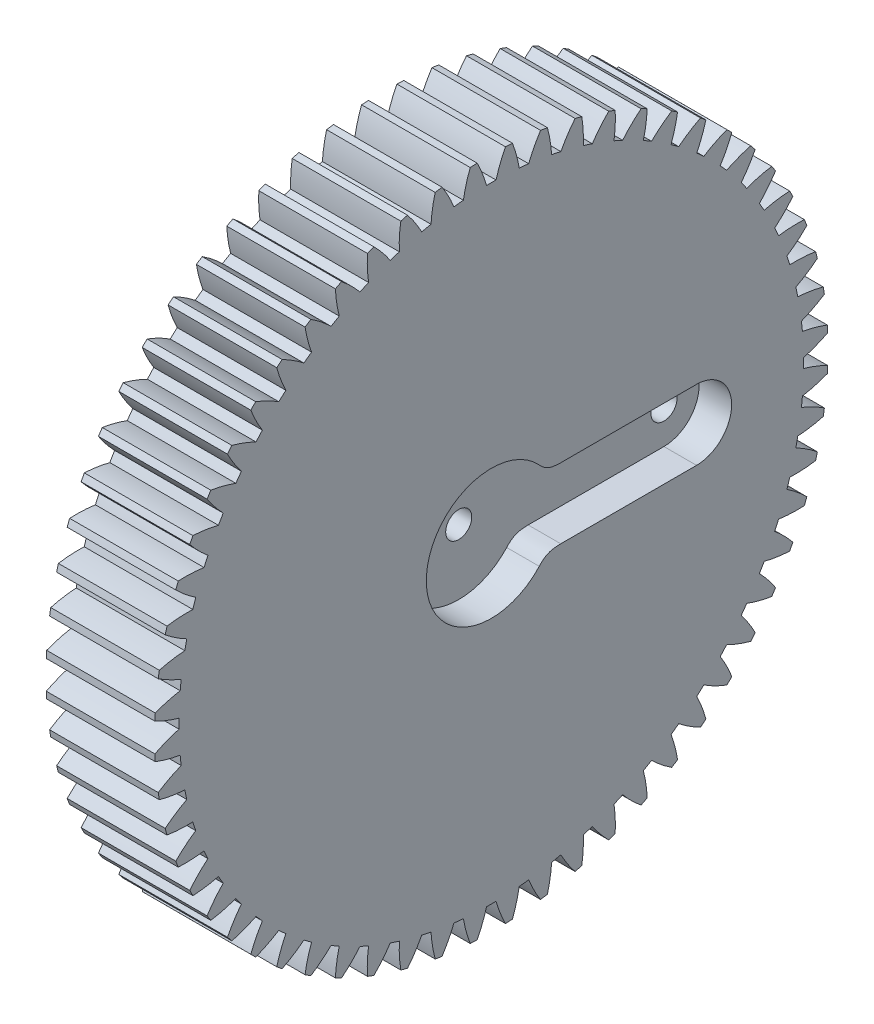
from build123d import *

# Parameters (mm, degrees)
SKETCH1_R           = 3.175
BOSS_EXTRUDE1_DEPTH = 12.7
CUT_EXTRUDE1_DEPTH  = 3.81
SKETCH4_R           = 1.524
CUT_EXTRUDE2_DEPTH  = 57.334221032
SKETCH5_R           = 3.175
CUT_EXTRUDE3_DEPTH  = 2.54
BOSS_EXTRUDE2_START = -8.89
SKETCH6_R           = 3.175
SKETCH6_R_2         = 1.524
BOSS_EXTRUDE2_DEPTH = 6.35


with BuildPart() as part:
    # Sketch1 → Boss-Extrude1 (new body)
    with BuildSketch(Plane(origin=(0, 0, 0), x_dir=(0, 0, -1), z_dir=(1, 0, 0))):
        with BuildLine():
            ThreePointArc((-39.335177282, 1.655514489), (-37.955442803, 1.035058015), (-36.520991483, 0.554451235))
            ThreePointArc((-36.520991483, 0.554451235), (-36.5252, 0), (-36.520991483, -0.554451235))
            ThreePointArc((-36.520991483, -0.554451235), (-37.955442803, -1.035058015), (-39.335177282, -1.655514489))
            ThreePointArc((-39.335177282, -1.655514489), (-39.316044783, -2.060466597), (-39.29274345, -2.465200226))
            ThreePointArc((-39.29274345, -2.465200226), (-37.85571194, -2.93803625), (-36.378881605, -3.266069224))
            ThreePointArc((-36.378881605, -3.266069224), (-36.325111133, -3.817923027), (-36.262969734, -4.36889701))
            ThreePointArc((-36.262969734, -4.36889701), (-37.639325892, -4.996811967), (-38.946646679, -5.758091041))
            ThreePointArc((-38.946646679, -5.758091041), (-38.885289969, -6.158824889), (-38.819810099, -6.558905692))
            ThreePointArc((-38.819810099, -6.558905692), (-37.341225974, -6.878940775), (-35.838197089, -7.050805945))
            ThreePointArc((-35.838197089, -7.050805945), (-35.727036746, -7.594016089), (-35.607643301, -8.135476234))
            ThreePointArc((-35.607643301, -8.135476234), (-36.910824651, -8.903819803), (-38.131408466, -9.797580742))
            ThreePointArc((-38.131408466, -9.797580742), (-38.028499781, -10.189705806), (-37.921558785, -10.580750414))
            ThreePointArc((-37.921558785, -10.580750414), (-36.417621723, -10.744478186), (-34.904861785, -10.75829256))
            ThreePointArc((-34.904861785, -10.75829256), (-34.737529469, -11.286907523), (-34.562192077, -11.812921479))
            ThreePointArc((-34.562192077, -11.812921479), (-35.77792069, -12.713275525), (-36.898394562, -13.729726099))
            ThreePointArc((-36.898394562, -13.729726099), (-36.755061391, -14.108946174), (-36.607830937, -14.486670221))
            ThreePointArc((-36.607830937, -14.486670221), (-35.095018388, -14.492296845), (-33.589101511, -14.34790907))
            ThreePointArc((-33.589101511, -14.34790907), (-33.367430549, -14.856137236), (-33.138070244, -15.360941884))
            ThreePointArc((-33.138070244, -15.360941884), (-34.253026343, -16.38344194), (-35.261114125, -17.511445704))
            ThreePointArc((-35.261114125, -17.511445704), (-35.078926857, -17.873605975), (-34.893020033, -18.233871037))
            ThreePointArc((-34.893020033, -18.233871037), (-33.387906687, -18.081334866), (-31.905332013, -17.780326887))
            ThreePointArc((-31.905332013, -17.780326887), (-31.631751078, -18.2626), (-31.350880778, -18.740664596))
            ThreePointArc((-31.350880778, -18.740664596), (-32.352848672, -19.874107937), (-33.237505544, -21.101306244))
            ThreePointArc((-33.237505544, -21.101306244), (-33.01846026, -21.442438809), (-32.795913899, -21.781297747))
            ThreePointArc((-32.795913899, -21.781297747), (-31.314990093, -21.47227), (-29.87200102, -21.017939721))
            ThreePointArc((-29.87200102, -21.017939721), (-29.549507523, -21.468973897), (-29.220204502, -21.915060664))
            ThreePointArc((-29.220204502, -21.915060664), (-30.09820642, -23.147029048), (-30.849739896, -24.459976458))
            ThreePointArc((-30.849739896, -24.459976458), (-30.596236503, -24.776343796), (-30.33948887, -25.090084))
            ThreePointArc((-30.33948887, -25.090084), (-28.898979915, -24.62795045), (-27.511386132, -24.025275609))
            ThreePointArc((-27.511386132, -24.025275609), (-27.14351338, -24.440129223), (-26.769385551, -24.849350742))
            ThreePointArc((-26.769385551, -24.849350742), (-27.513801921, -26.166346465), (-28.123978042, -27.550658052))
            ThreePointArc((-28.123978042, -27.550658052), (-27.838793975, -27.838793975), (-27.550658052, -28.123978042))
            ThreePointArc((-27.550658052, -28.123978042), (-26.166346465, -27.513801921), (-24.849350742, -26.769385551))
            ThreePointArc((-24.849350742, -26.769385551), (-24.440129223, -27.14351338), (-24.025275609, -27.511386132))
            ThreePointArc((-24.025275609, -27.511386132), (-24.62795045, -28.898979915), (-25.090084, -30.33948887))
            ThreePointArc((-25.090084, -30.33948887), (-24.776343796, -30.596236503), (-24.459976458, -30.849739896))
            ThreePointArc((-24.459976458, -30.849739896), (-23.147029048, -30.09820642), (-21.915060664, -29.220204502))
            ThreePointArc((-21.915060664, -29.220204502), (-21.468973897, -29.549507523), (-21.017939721, -29.87200102))
            ThreePointArc((-21.017939721, -29.87200102), (-21.47227, -31.314990093), (-21.781297747, -32.795913899))
            ThreePointArc((-21.781297747, -32.795913899), (-21.442438809, -33.01846026), (-21.101306244, -33.237505544))
            ThreePointArc((-21.101306244, -33.237505544), (-19.874107937, -32.352848672), (-18.740664596, -31.350880778))
            ThreePointArc((-18.740664596, -31.350880778), (-18.2626, -31.631751078), (-17.780326887, -31.905332013))
            ThreePointArc((-17.780326887, -31.905332013), (-18.081334866, -33.387906687), (-18.233871037, -34.893020033))
            ThreePointArc((-18.233871037, -34.893020033), (-17.873605975, -35.078926857), (-17.511445704, -35.261114125))
            ThreePointArc((-17.511445704, -35.261114125), (-16.38344194, -34.253026343), (-15.360941884, -33.138070244))
            ThreePointArc((-15.360941884, -33.138070244), (-14.856137236, -33.367430549), (-14.34790907, -33.589101511))
            ThreePointArc((-14.34790907, -33.589101511), (-14.492296845, -35.095018388), (-14.486670221, -36.607830937))
            ThreePointArc((-14.486670221, -36.607830937), (-14.108946174, -36.755061391), (-13.729726099, -36.898394562))
            ThreePointArc((-13.729726099, -36.898394562), (-12.713275525, -35.77792069), (-11.812921479, -34.562192077))
            ThreePointArc((-11.812921479, -34.562192077), (-11.286907523, -34.737529469), (-10.75829256, -34.904861785))
            ThreePointArc((-10.75829256, -34.904861785), (-10.744478186, -36.417621723), (-10.580750414, -37.921558785))
            ThreePointArc((-10.580750414, -37.921558785), (-10.189705806, -38.028499781), (-9.797580742, -38.131408466))
            ThreePointArc((-9.797580742, -38.131408466), (-8.903819803, -36.910824651), (-8.135476234, -35.607643301))
            ThreePointArc((-8.135476234, -35.607643301), (-7.594016089, -35.727036746), (-7.050805945, -35.838197089))
            ThreePointArc((-7.050805945, -35.838197089), (-6.878940775, -37.341225974), (-6.558905692, -38.819810099))
            ThreePointArc((-6.558905692, -38.819810099), (-6.158824889, -38.885289969), (-5.758091041, -38.946646679))
            ThreePointArc((-5.758091041, -38.946646679), (-4.996811967, -37.639325892), (-4.36889701, -36.262969734))
            ThreePointArc((-4.36889701, -36.262969734), (-3.817923027, -36.325111133), (-3.266069224, -36.378881605))
            ThreePointArc((-3.266069224, -36.378881605), (-2.93803625, -37.85571194), (-2.465200226, -39.29274345))
            ThreePointArc((-2.465200226, -39.29274345), (-2.060466597, -39.316044783), (-1.655514489, -39.335177282))
            ThreePointArc((-1.655514489, -39.335177282), (-1.035058015, -37.955442803), (-0.554451235, -36.520991483))
            ThreePointArc((-0.554451235, -36.520991483), (0, -36.5252), (0.554451235, -36.520991483))
            ThreePointArc((0.554451235, -36.520991483), (1.035058015, -37.955442803), (1.655514489, -39.335177282))
            ThreePointArc((1.655514489, -39.335177282), (2.060466597, -39.316044783), (2.465200226, -39.29274345))
            ThreePointArc((2.465200226, -39.29274345), (2.93803625, -37.85571194), (3.266069224, -36.378881605))
            ThreePointArc((3.266069224, -36.378881605), (3.817923027, -36.325111133), (4.36889701, -36.262969734))
            ThreePointArc((4.36889701, -36.262969734), (4.996811967, -37.639325892), (5.758091041, -38.946646679))
            ThreePointArc((5.758091041, -38.946646679), (6.158824889, -38.885289969), (6.558905692, -38.819810099))
            ThreePointArc((6.558905692, -38.819810099), (6.878940775, -37.341225974), (7.050805945, -35.838197089))
            ThreePointArc((7.050805945, -35.838197089), (7.594016089, -35.727036746), (8.135476234, -35.607643301))
            ThreePointArc((8.135476234, -35.607643301), (8.903819803, -36.910824651), (9.797580742, -38.131408466))
            ThreePointArc((9.797580742, -38.131408466), (10.189705806, -38.028499781), (10.580750414, -37.921558785))
            ThreePointArc((10.580750414, -37.921558785), (10.744478186, -36.417621723), (10.75829256, -34.904861785))
            ThreePointArc((10.75829256, -34.904861785), (11.286907523, -34.737529469), (11.812921479, -34.562192077))
            ThreePointArc((11.812921479, -34.562192077), (12.713275525, -35.77792069), (13.729726099, -36.898394562))
            ThreePointArc((13.729726099, -36.898394562), (14.108946174, -36.755061391), (14.486670221, -36.607830937))
            ThreePointArc((14.486670221, -36.607830937), (14.492296845, -35.095018388), (14.34790907, -33.589101511))
            ThreePointArc((14.34790907, -33.589101511), (14.856137236, -33.367430549), (15.360941884, -33.138070244))
            ThreePointArc((15.360941884, -33.138070244), (16.38344194, -34.253026343), (17.511445704, -35.261114125))
            ThreePointArc((17.511445704, -35.261114125), (17.873605975, -35.078926857), (18.233871037, -34.893020033))
            ThreePointArc((18.233871037, -34.893020033), (18.081334866, -33.387906687), (17.780326887, -31.905332013))
            ThreePointArc((17.780326887, -31.905332013), (18.2626, -31.631751078), (18.740664596, -31.350880778))
            ThreePointArc((18.740664596, -31.350880778), (19.874107937, -32.352848672), (21.101306244, -33.237505544))
            ThreePointArc((21.101306244, -33.237505544), (21.442438809, -33.01846026), (21.781297747, -32.795913899))
            ThreePointArc((21.781297747, -32.795913899), (21.47227, -31.314990093), (21.017939721, -29.87200102))
            ThreePointArc((21.017939721, -29.87200102), (21.468973897, -29.549507523), (21.915060664, -29.220204502))
            ThreePointArc((21.915060664, -29.220204502), (23.147029048, -30.09820642), (24.459976458, -30.849739896))
            ThreePointArc((24.459976458, -30.849739896), (24.776343796, -30.596236503), (25.090084, -30.33948887))
            ThreePointArc((25.090084, -30.33948887), (24.62795045, -28.898979915), (24.025275609, -27.511386132))
            ThreePointArc((24.025275609, -27.511386132), (24.440129223, -27.14351338), (24.849350742, -26.769385551))
            ThreePointArc((24.849350742, -26.769385551), (26.166346465, -27.513801921), (27.550658052, -28.123978042))
            ThreePointArc((27.550658052, -28.123978042), (27.838793975, -27.838793975), (28.123978042, -27.550658052))
            ThreePointArc((28.123978042, -27.550658052), (27.513801921, -26.166346465), (26.769385551, -24.849350742))
            ThreePointArc((26.769385551, -24.849350742), (27.14351338, -24.440129223), (27.511386132, -24.025275609))
            ThreePointArc((27.511386132, -24.025275609), (28.898979915, -24.62795045), (30.33948887, -25.090084))
            ThreePointArc((30.33948887, -25.090084), (30.596236503, -24.776343796), (30.849739896, -24.459976458))
            ThreePointArc((30.849739896, -24.459976458), (30.09820642, -23.147029048), (29.220204502, -21.915060664))
            ThreePointArc((29.220204502, -21.915060664), (29.549507523, -21.468973897), (29.87200102, -21.017939721))
            ThreePointArc((29.87200102, -21.017939721), (31.314990093, -21.47227), (32.795913899, -21.781297747))
            ThreePointArc((32.795913899, -21.781297747), (33.01846026, -21.442438809), (33.237505544, -21.101306244))
            ThreePointArc((33.237505544, -21.101306244), (32.352848672, -19.874107937), (31.350880778, -18.740664596))
            ThreePointArc((31.350880778, -18.740664596), (31.631751078, -18.2626), (31.905332013, -17.780326887))
            ThreePointArc((31.905332013, -17.780326887), (33.387906687, -18.081334866), (34.893020033, -18.233871037))
            ThreePointArc((34.893020033, -18.233871037), (35.078926857, -17.873605975), (35.261114125, -17.511445704))
            ThreePointArc((35.261114125, -17.511445704), (34.253026343, -16.38344194), (33.138070244, -15.360941884))
            ThreePointArc((33.138070244, -15.360941884), (33.367430549, -14.856137236), (33.589101511, -14.34790907))
            ThreePointArc((33.589101511, -14.34790907), (35.095018388, -14.492296845), (36.607830937, -14.486670221))
            ThreePointArc((36.607830937, -14.486670221), (36.755061391, -14.108946174), (36.898394562, -13.729726099))
            ThreePointArc((36.898394562, -13.729726099), (35.77792069, -12.713275525), (34.562192077, -11.812921479))
            ThreePointArc((34.562192077, -11.812921479), (34.737529469, -11.286907523), (34.904861785, -10.75829256))
            ThreePointArc((34.904861785, -10.75829256), (36.417621723, -10.744478186), (37.921558785, -10.580750414))
            ThreePointArc((37.921558785, -10.580750414), (38.028499781, -10.189705806), (38.131408466, -9.797580742))
            ThreePointArc((38.131408466, -9.797580742), (36.910824651, -8.903819803), (35.607643301, -8.135476234))
            ThreePointArc((35.607643301, -8.135476234), (35.727036746, -7.594016089), (35.838197089, -7.050805945))
            ThreePointArc((35.838197089, -7.050805945), (37.341225974, -6.878940775), (38.819810099, -6.558905692))
            ThreePointArc((38.819810099, -6.558905692), (38.885289969, -6.158824889), (38.946646679, -5.758091041))
            ThreePointArc((38.946646679, -5.758091041), (37.639325892, -4.996811967), (36.262969734, -4.36889701))
            ThreePointArc((36.262969734, -4.36889701), (36.325111133, -3.817923027), (36.378881605, -3.266069224))
            ThreePointArc((36.378881605, -3.266069224), (37.85571194, -2.93803625), (39.29274345, -2.465200226))
            ThreePointArc((39.29274345, -2.465200226), (39.316044783, -2.060466597), (39.335177282, -1.655514489))
            ThreePointArc((39.335177282, -1.655514489), (37.955442803, -1.035058015), (36.520991483, -0.554451235))
            ThreePointArc((36.520991483, -0.554451235), (36.5252, 0), (36.520991483, 0.554451235))
            ThreePointArc((36.520991483, 0.554451235), (37.955442803, 1.035058015), (39.335177282, 1.655514489))
            ThreePointArc((39.335177282, 1.655514489), (39.316044783, 2.060466597), (39.29274345, 2.465200226))
            ThreePointArc((39.29274345, 2.465200226), (37.85571194, 2.93803625), (36.378881605, 3.266069224))
            ThreePointArc((36.378881605, 3.266069224), (36.325111133, 3.817923027), (36.262969734, 4.36889701))
            ThreePointArc((36.262969734, 4.36889701), (37.639325892, 4.996811967), (38.946646679, 5.758091041))
            ThreePointArc((38.946646679, 5.758091041), (38.885289969, 6.158824889), (38.819810099, 6.558905692))
            ThreePointArc((38.819810099, 6.558905692), (37.341225974, 6.878940775), (35.838197089, 7.050805945))
            ThreePointArc((35.838197089, 7.050805945), (35.727036746, 7.594016089), (35.607643301, 8.135476234))
            ThreePointArc((35.607643301, 8.135476234), (36.910824651, 8.903819803), (38.131408466, 9.797580742))
            ThreePointArc((38.131408466, 9.797580742), (38.028499781, 10.189705806), (37.921558785, 10.580750414))
            ThreePointArc((37.921558785, 10.580750414), (36.417621723, 10.744478186), (34.904861785, 10.75829256))
            ThreePointArc((34.904861785, 10.75829256), (34.737529469, 11.286907523), (34.562192077, 11.812921479))
            ThreePointArc((34.562192077, 11.812921479), (35.77792069, 12.713275525), (36.898394562, 13.729726099))
            ThreePointArc((36.898394562, 13.729726099), (36.755061391, 14.108946174), (36.607830937, 14.486670221))
            ThreePointArc((36.607830937, 14.486670221), (35.095018388, 14.492296845), (33.589101511, 14.34790907))
            ThreePointArc((33.589101511, 14.34790907), (33.367430549, 14.856137236), (33.138070244, 15.360941884))
            ThreePointArc((33.138070244, 15.360941884), (34.253026343, 16.38344194), (35.261114125, 17.511445704))
            ThreePointArc((35.261114125, 17.511445704), (35.078926857, 17.873605975), (34.893020033, 18.233871037))
            ThreePointArc((34.893020033, 18.233871037), (33.387906687, 18.081334866), (31.905332013, 17.780326887))
            ThreePointArc((31.905332013, 17.780326887), (31.631751078, 18.2626), (31.350880778, 18.740664596))
            ThreePointArc((31.350880778, 18.740664596), (32.352848672, 19.874107937), (33.237505544, 21.101306244))
            ThreePointArc((33.237505544, 21.101306244), (33.01846026, 21.442438809), (32.795913899, 21.781297747))
            ThreePointArc((32.795913899, 21.781297747), (31.314990093, 21.47227), (29.87200102, 21.017939721))
            ThreePointArc((29.87200102, 21.017939721), (29.549507523, 21.468973897), (29.220204502, 21.915060664))
            ThreePointArc((29.220204502, 21.915060664), (30.09820642, 23.147029048), (30.849739896, 24.459976458))
            ThreePointArc((30.849739896, 24.459976458), (30.596236503, 24.776343796), (30.33948887, 25.090084))
            ThreePointArc((30.33948887, 25.090084), (28.898979915, 24.62795045), (27.511386132, 24.025275609))
            ThreePointArc((27.511386132, 24.025275609), (27.14351338, 24.440129223), (26.769385551, 24.849350742))
            ThreePointArc((26.769385551, 24.849350742), (27.513801921, 26.166346465), (28.123978042, 27.550658052))
            ThreePointArc((28.123978042, 27.550658052), (27.838793975, 27.838793975), (27.550658052, 28.123978042))
            ThreePointArc((27.550658052, 28.123978042), (26.166346465, 27.513801921), (24.849350742, 26.769385551))
            ThreePointArc((24.849350742, 26.769385551), (24.440129223, 27.14351338), (24.025275609, 27.511386132))
            ThreePointArc((24.025275609, 27.511386132), (24.62795045, 28.898979915), (25.090084, 30.33948887))
            ThreePointArc((25.090084, 30.33948887), (24.776343796, 30.596236503), (24.459976458, 30.849739896))
            ThreePointArc((24.459976458, 30.849739896), (23.147029048, 30.09820642), (21.915060664, 29.220204502))
            ThreePointArc((21.915060664, 29.220204502), (21.468973897, 29.549507523), (21.017939721, 29.87200102))
            ThreePointArc((21.017939721, 29.87200102), (21.47227, 31.314990093), (21.781297747, 32.795913899))
            ThreePointArc((21.781297747, 32.795913899), (21.442438809, 33.01846026), (21.101306244, 33.237505544))
            ThreePointArc((21.101306244, 33.237505544), (19.874107937, 32.352848672), (18.740664596, 31.350880778))
            ThreePointArc((18.740664596, 31.350880778), (18.2626, 31.631751078), (17.780326887, 31.905332013))
            ThreePointArc((17.780326887, 31.905332013), (18.081334866, 33.387906687), (18.233871037, 34.893020033))
            ThreePointArc((18.233871037, 34.893020033), (17.873605975, 35.078926857), (17.511445704, 35.261114125))
            ThreePointArc((17.511445704, 35.261114125), (16.38344194, 34.253026343), (15.360941884, 33.138070244))
            ThreePointArc((15.360941884, 33.138070244), (14.856137236, 33.367430549), (14.34790907, 33.589101511))
            ThreePointArc((14.34790907, 33.589101511), (14.492296845, 35.095018388), (14.486670221, 36.607830937))
            ThreePointArc((14.486670221, 36.607830937), (14.108946174, 36.755061391), (13.729726099, 36.898394562))
            ThreePointArc((13.729726099, 36.898394562), (12.713275525, 35.77792069), (11.812921479, 34.562192077))
            ThreePointArc((11.812921479, 34.562192077), (11.286907523, 34.737529469), (10.75829256, 34.904861785))
            ThreePointArc((10.75829256, 34.904861785), (10.744478186, 36.417621723), (10.580750414, 37.921558785))
            ThreePointArc((10.580750414, 37.921558785), (10.189705806, 38.028499781), (9.797580742, 38.131408466))
            ThreePointArc((9.797580742, 38.131408466), (8.903819803, 36.910824651), (8.135476234, 35.607643301))
            ThreePointArc((8.135476234, 35.607643301), (7.594016089, 35.727036746), (7.050805945, 35.838197089))
            ThreePointArc((7.050805945, 35.838197089), (6.878940775, 37.341225974), (6.558905692, 38.819810099))
            ThreePointArc((6.558905692, 38.819810099), (6.158824889, 38.885289969), (5.758091041, 38.946646679))
            ThreePointArc((5.758091041, 38.946646679), (4.996811967, 37.639325892), (4.36889701, 36.262969734))
            ThreePointArc((4.36889701, 36.262969734), (3.817923027, 36.325111133), (3.266069224, 36.378881605))
            ThreePointArc((3.266069224, 36.378881605), (2.93803625, 37.85571194), (2.465200226, 39.29274345))
            ThreePointArc((2.465200226, 39.29274345), (2.060466597, 39.316044783), (1.655514489, 39.335177282))
            ThreePointArc((1.655514489, 39.335177282), (1.035058015, 37.955442803), (0.554451235, 36.520991483))
            ThreePointArc((0.554451235, 36.520991483), (0, 36.5252), (-0.554451235, 36.520991483))
            ThreePointArc((-0.554451235, 36.520991483), (-1.035058015, 37.955442803), (-1.655514489, 39.335177282))
            ThreePointArc((-1.655514489, 39.335177282), (-2.060466597, 39.316044783), (-2.465200226, 39.29274345))
            ThreePointArc((-2.465200226, 39.29274345), (-2.93803625, 37.85571194), (-3.266069224, 36.378881605))
            ThreePointArc((-3.266069224, 36.378881605), (-3.817923027, 36.325111133), (-4.36889701, 36.262969734))
            ThreePointArc((-4.36889701, 36.262969734), (-4.996811967, 37.639325892), (-5.758091041, 38.946646679))
            ThreePointArc((-5.758091041, 38.946646679), (-6.158824889, 38.885289969), (-6.558905692, 38.819810099))
            ThreePointArc((-6.558905692, 38.819810099), (-6.878940775, 37.341225974), (-7.050805945, 35.838197089))
            ThreePointArc((-7.050805945, 35.838197089), (-7.594016089, 35.727036746), (-8.135476234, 35.607643301))
            ThreePointArc((-8.135476234, 35.607643301), (-8.903819803, 36.910824651), (-9.797580742, 38.131408466))
            ThreePointArc((-9.797580742, 38.131408466), (-10.189705806, 38.028499781), (-10.580750414, 37.921558785))
            ThreePointArc((-10.580750414, 37.921558785), (-10.744478186, 36.417621723), (-10.75829256, 34.904861785))
            ThreePointArc((-10.75829256, 34.904861785), (-11.286907523, 34.737529469), (-11.812921479, 34.562192077))
            ThreePointArc((-11.812921479, 34.562192077), (-12.713275525, 35.77792069), (-13.729726099, 36.898394562))
            ThreePointArc((-13.729726099, 36.898394562), (-14.108946174, 36.755061391), (-14.486670221, 36.607830937))
            ThreePointArc((-14.486670221, 36.607830937), (-14.492296845, 35.095018388), (-14.34790907, 33.589101511))
            ThreePointArc((-14.34790907, 33.589101511), (-14.856137236, 33.367430549), (-15.360941884, 33.138070244))
            ThreePointArc((-15.360941884, 33.138070244), (-16.38344194, 34.253026343), (-17.511445704, 35.261114125))
            ThreePointArc((-17.511445704, 35.261114125), (-17.873605975, 35.078926857), (-18.233871037, 34.893020033))
            ThreePointArc((-18.233871037, 34.893020033), (-18.081334866, 33.387906687), (-17.780326887, 31.905332013))
            ThreePointArc((-17.780326887, 31.905332013), (-18.2626, 31.631751078), (-18.740664596, 31.350880778))
            ThreePointArc((-18.740664596, 31.350880778), (-19.874107937, 32.352848672), (-21.101306244, 33.237505544))
            ThreePointArc((-21.101306244, 33.237505544), (-21.442438809, 33.01846026), (-21.781297747, 32.795913899))
            ThreePointArc((-21.781297747, 32.795913899), (-21.47227, 31.314990093), (-21.017939721, 29.87200102))
            ThreePointArc((-21.017939721, 29.87200102), (-21.468973897, 29.549507523), (-21.915060664, 29.220204502))
            ThreePointArc((-21.915060664, 29.220204502), (-23.147029048, 30.09820642), (-24.459976458, 30.849739896))
            ThreePointArc((-24.459976458, 30.849739896), (-24.776343796, 30.596236503), (-25.090084, 30.33948887))
            ThreePointArc((-25.090084, 30.33948887), (-24.62795045, 28.898979915), (-24.025275609, 27.511386132))
            ThreePointArc((-24.025275609, 27.511386132), (-24.440129223, 27.14351338), (-24.849350742, 26.769385551))
            ThreePointArc((-24.849350742, 26.769385551), (-26.166346465, 27.513801921), (-27.550658052, 28.123978042))
            ThreePointArc((-27.550658052, 28.123978042), (-27.838793975, 27.838793975), (-28.123978042, 27.550658052))
            ThreePointArc((-28.123978042, 27.550658052), (-27.513801921, 26.166346465), (-26.769385551, 24.849350742))
            ThreePointArc((-26.769385551, 24.849350742), (-27.14351338, 24.440129223), (-27.511386132, 24.025275609))
            ThreePointArc((-27.511386132, 24.025275609), (-28.898979915, 24.62795045), (-30.33948887, 25.090084))
            ThreePointArc((-30.33948887, 25.090084), (-30.596236503, 24.776343796), (-30.849739896, 24.459976458))
            ThreePointArc((-30.849739896, 24.459976458), (-30.09820642, 23.147029048), (-29.220204502, 21.915060664))
            ThreePointArc((-29.220204502, 21.915060664), (-29.549507523, 21.468973897), (-29.87200102, 21.017939721))
            ThreePointArc((-29.87200102, 21.017939721), (-31.314990093, 21.47227), (-32.795913899, 21.781297747))
            ThreePointArc((-32.795913899, 21.781297747), (-33.01846026, 21.442438809), (-33.237505544, 21.101306244))
            ThreePointArc((-33.237505544, 21.101306244), (-32.352848672, 19.874107937), (-31.350880778, 18.740664596))
            ThreePointArc((-31.350880778, 18.740664596), (-31.631751078, 18.2626), (-31.905332013, 17.780326887))
            ThreePointArc((-31.905332013, 17.780326887), (-33.387906687, 18.081334866), (-34.893020033, 18.233871037))
            ThreePointArc((-34.893020033, 18.233871037), (-35.078926857, 17.873605975), (-35.261114125, 17.511445704))
            ThreePointArc((-35.261114125, 17.511445704), (-34.253026343, 16.38344194), (-33.138070244, 15.360941884))
            ThreePointArc((-33.138070244, 15.360941884), (-33.367430549, 14.856137236), (-33.589101511, 14.34790907))
            ThreePointArc((-33.589101511, 14.34790907), (-35.095018388, 14.492296845), (-36.607830937, 14.486670221))
            ThreePointArc((-36.607830937, 14.486670221), (-36.755061391, 14.108946174), (-36.898394562, 13.729726099))
            ThreePointArc((-36.898394562, 13.729726099), (-35.77792069, 12.713275525), (-34.562192077, 11.812921479))
            ThreePointArc((-34.562192077, 11.812921479), (-34.737529469, 11.286907523), (-34.904861785, 10.75829256))
            ThreePointArc((-34.904861785, 10.75829256), (-36.417621723, 10.744478186), (-37.921558785, 10.580750414))
            ThreePointArc((-37.921558785, 10.580750414), (-38.028499781, 10.189705806), (-38.131408466, 9.797580742))
            ThreePointArc((-38.131408466, 9.797580742), (-36.910824651, 8.903819803), (-35.607643301, 8.135476234))
            ThreePointArc((-35.607643301, 8.135476234), (-35.727036746, 7.594016089), (-35.838197089, 7.050805945))
            ThreePointArc((-35.838197089, 7.050805945), (-37.341225974, 6.878940775), (-38.819810099, 6.558905692))
            ThreePointArc((-38.819810099, 6.558905692), (-38.885289969, 6.158824889), (-38.946646679, 5.758091041))
            ThreePointArc((-38.946646679, 5.758091041), (-37.639325892, 4.996811967), (-36.262969734, 4.36889701))
            ThreePointArc((-36.262969734, 4.36889701), (-36.325111133, 3.817923027), (-36.378881605, 3.266069224))
            ThreePointArc((-36.378881605, 3.266069224), (-37.85571194, 2.93803625), (-39.29274345, 2.465200226))
            ThreePointArc((-39.29274345, 2.465200226), (-39.316044783, 2.060466597), (-39.335177282, 1.655514489))
        make_face()
        with Locations(Location((0, 0, 0), (0, 0, 180))):
            Circle(SKETCH1_R, mode=Mode.SUBTRACT)
    extrude(amount=-BOSS_EXTRUDE1_DEPTH)

    # Sketch3 → Cut-Extrude1 (cut)
    with BuildSketch(Plane.ZY):
        with BuildLine():
            Line((-24, 4.1016), (-8.118180831, 4.1016))
            add(Edge.make_bspline(
                [(-5.609527947, 5.130060309), (-6.580369701, 4.029972639), (-7.421845879, 4.167133619), (-8.118180831, 4.1016)],
                knots=[0, 0, 0, 0, 1, 1, 1, 1], degree=3))
            ThreePointArc((-5.609527947, 5.130060309), (7.6016, 0), (-5.609527947, -5.130060309))
            add(Edge.make_bspline(
                [(-5.609527947, -5.130060309), (-6.580369701, -4.029972639), (-7.421845879, -4.167133619), (-8.118180831, -4.1016)],
                knots=[0, 0, 0, 0, 1, 1, 1, 1], degree=3))
            Line((-8.118180831, -4.1016), (-24, -4.1016))
            ThreePointArc((-24, -4.1016), (-28.1016, 0), (-24, 4.1016))
        make_face()
    extrude(amount=CUT_EXTRUDE1_DEPTH, mode=Mode.SUBTRACT)

    # Sketch4 → Cut-Extrude2 (cut, through all)
    with BuildSketch(Plane(origin=(-3.81, 0, 0), x_dir=(0, 0, -1), z_dir=(1, 0, 0))):
        with Locations((24, 0)):
            Circle(SKETCH4_R)
    extrude(amount=-CUT_EXTRUDE2_DEPTH, mode=Mode.SUBTRACT)

    # Sketch5 → Cut-Extrude3 (cut)
    with BuildSketch(Plane.ZY.offset(12.7)):
        with Locations((-24, 0)):
            Circle(SKETCH5_R)
    extrude(amount=-CUT_EXTRUDE3_DEPTH, mode=Mode.SUBTRACT)

    # Sketch6 → Boss-Extrude2 (add)
    with BuildSketch(Plane.ZY.offset(12.7).offset(BOSS_EXTRUDE2_START)):
        Circle(SKETCH6_R)
        Circle(SKETCH6_R_2, mode=Mode.SUBTRACT)
    extrude(amount=BOSS_EXTRUDE2_DEPTH)


solid = part.part
